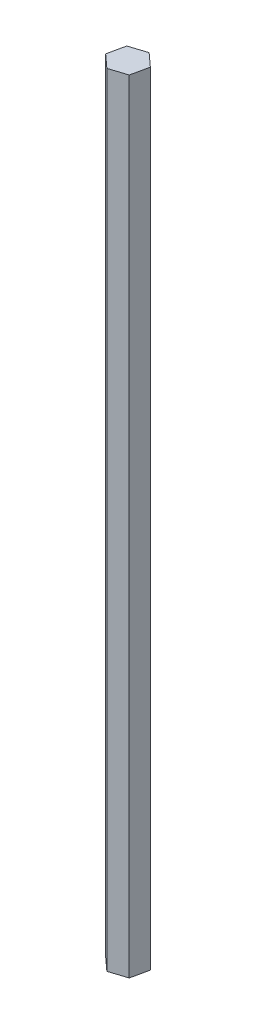
from build123d import *

# Parameters (mm, degrees)
BOSS_EXTRUDE1_DEPTH = 127


with BuildPart() as part:
    # Sketch2 → Boss-Extrude1 (new body)
    with BuildSketch(Plane(origin=(0, 0, 0), x_dir=(1, 0, 0), z_dir=(0, 1, 0))):
        Polygon((2.137295047, -1.940438924), (2.749116926, 0.880732344), (0.611821879, 2.821171268), (-2.137295047, 1.940438924), (-2.749116926, -0.880732344), (-0.611821879, -2.821171268), align=None)
    extrude(amount=BOSS_EXTRUDE1_DEPTH)


solid = part.part
